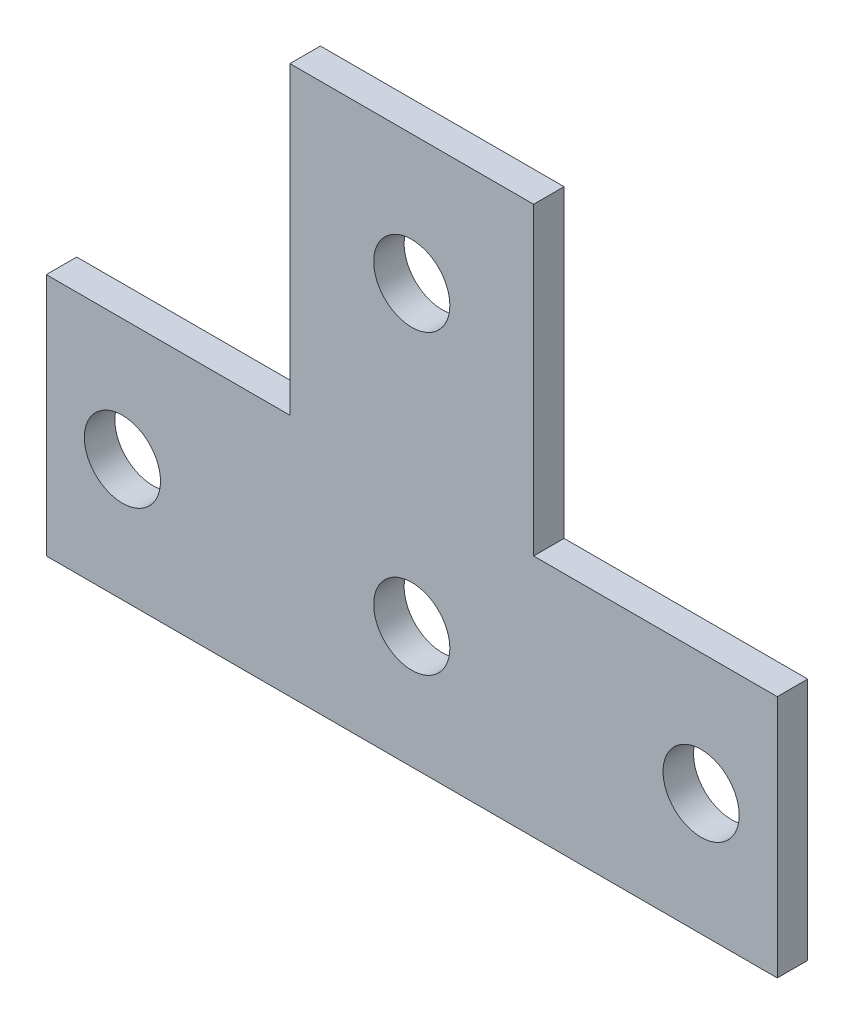
from build123d import *

# Parameters (mm, degrees)
SKETCH2_R           = 2.5
EXTRUDE1_DEPTH      = 2
SKETCH_1_W          = 16
SKETCH_1_H          = 34
CUT_EXTRUDE_1_DEPTH = 60.126981996


with BuildPart() as part:
    # Sketch2 → Extrude1 (new body)
    with BuildSketch(Plane.XY):
        Polygon((-8, 0), (-8, 54), (8, 54), (8, 0), (24, 0), (24, -16), (-24, -16), (-24, 0), align=None)
        with Locations((19, -8)):
            Circle(SKETCH2_R, mode=Mode.SUBTRACT)
        with Locations((0, -8)):
            Circle(SKETCH2_R, mode=Mode.SUBTRACT)
        with Locations((-19, -8)):
            Circle(SKETCH2_R, mode=Mode.SUBTRACT)
        with Locations((0, 43.75)):
            Circle(SKETCH2_R, mode=Mode.SUBTRACT)
        with Locations((0, 11.5)):
            Circle(SKETCH2_R, mode=Mode.SUBTRACT)
    extrude(amount=EXTRUDE1_DEPTH)

    # Эскиз1 → Вырез-Вытянуть1 (cut, through all)
    with BuildSketch(Plane.XY.offset(2)):
        with Locations((0, 37)):
            Rectangle(SKETCH_1_W, SKETCH_1_H)
    extrude(amount=-CUT_EXTRUDE_1_DEPTH, mode=Mode.SUBTRACT)


solid = part.part
